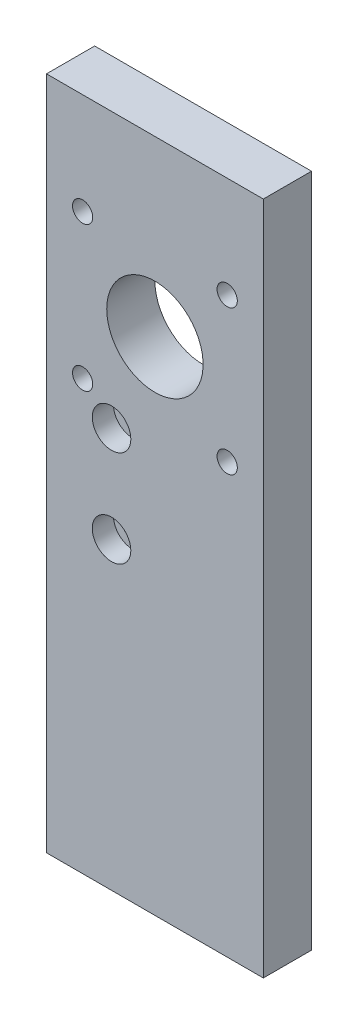
from build123d import *

# Parameters (mm, degrees)
SKIZZE1_W                                            = 45
SKIZZE1_H                                            = 140
AUFSATZ_LINEAR_AUSTRAGEN1_DEPTH                      = 5
STIRNSENKUNG_F_R_M4_ZYLINDERSCHRAUBE_MIT_D           = 4.5
STIRNSENKUNG_F_R_M4_ZYLINDERSCHRAUBE_MIT_CBORE_D     = 8
STIRNSENKUNG_F_R_M4_ZYLINDERSCHRAUBE_MIT_CBORE_DEPTH = 4.4
M5_GEWINDEBOHRUNG1_D                                 = 4.2
LINEARES_MUSTER1_COUNT                               = 2
LINEARES_MUSTER1_PITCH                               = 20
M5_GEWINDEBOHRUNG2_D                                 = 4.2
M5_GEWINDEBOHRUNG2_DEPTH                             = 14
M5_GEWINDEBOHRUNG2_TIP                               = 1.2618073
F_4_0_4_DURCHMESSER_BOHRUNG1_D                       = 4
F_4_0_4_DURCHMESSER_BOHRUNG1_DEPTH                   = 14
F_4_0_4_DURCHMESSER_BOHRUNG1_TIP                     = 1.201721238
F_3_0_3_DURCHMESSER_BOHRUNG1_D                       = 3
F_3_0_3_DURCHMESSER_BOHRUNG1_DEPTH                   = 8
F_20_0_20_DURCHMESSER_BOHRUNG1_D                     = 20


with BuildPart() as part:
    # Skizze1 → Aufsatz-Linear austragen1 (new, symmetric)
    with BuildSketch(Plane.XY):
        with Locations((0, 70)):
            Rectangle(SKIZZE1_W, SKIZZE1_H)
    extrude(amount=AUFSATZ_LINEAR_AUSTRAGEN1_DEPTH, both=True)

    # Stirnsenkung für M4 Zylinderschraube mit Innensechskant1 (through all)
    with Locations(Plane.XY.offset(5)):
        with Locations((-9, 83.08)):
            stirnsenkung_f_r_m4_zylinderschraube_mit = CounterBoreHole(STIRNSENKUNG_F_R_M4_ZYLINDERSCHRAUBE_MIT_D / 2, STIRNSENKUNG_F_R_M4_ZYLINDERSCHRAUBE_MIT_CBORE_D / 2, STIRNSENKUNG_F_R_M4_ZYLINDERSCHRAUBE_MIT_CBORE_DEPTH)

    # M5 Gewindebohrung1 (through all)
    with Locations(Plane.XY.offset(5)):
        with Locations((15, 119), (-15, 89), (-15, 119), (15, 89)):
            Hole(M5_GEWINDEBOHRUNG1_D / 2)

    # Lineares Muster1: Stirnsenkung für M4 Zylinderschraube mit Innensechskant1 ×2
    with Locations(*[(0, -i * LINEARES_MUSTER1_PITCH, 0) for i in range(1, LINEARES_MUSTER1_COUNT)]):
        add(stirnsenkung_f_r_m4_zylinderschraube_mit, mode=Mode.SUBTRACT)

    # M5 Gewindebohrung2
    with Locations(Plane(origin=(0, 0, 0), x_dir=(-1, 0, 0), z_dir=(0, -1, 0))):
        with Locations((0, 0)):
            Hole(M5_GEWINDEBOHRUNG2_D / 2, depth=M5_GEWINDEBOHRUNG2_DEPTH)
            with Locations((0, 0, -(M5_GEWINDEBOHRUNG2_DEPTH + M5_GEWINDEBOHRUNG2_TIP / 2))):  # 118° drill point
                Cone(0, M5_GEWINDEBOHRUNG2_D / 2, M5_GEWINDEBOHRUNG2_TIP, mode=Mode.SUBTRACT)

    # Ø4.0 (4) Durchmesser Bohrung1
    with Locations(Plane(origin=(0, 0, 0), x_dir=(-1, 0, 0), z_dir=(0, -1, 0))):
        with Locations((15, 0), (-15, 0)):
            Hole(F_4_0_4_DURCHMESSER_BOHRUNG1_D / 2, depth=F_4_0_4_DURCHMESSER_BOHRUNG1_DEPTH)
            with Locations((0, 0, -(F_4_0_4_DURCHMESSER_BOHRUNG1_DEPTH + F_4_0_4_DURCHMESSER_BOHRUNG1_TIP / 2))):  # 118° drill point
                Cone(0, F_4_0_4_DURCHMESSER_BOHRUNG1_D / 2, F_4_0_4_DURCHMESSER_BOHRUNG1_TIP, mode=Mode.SUBTRACT)

    # Ø3.0 (3) Durchmesser Bohrung1
    with Locations(Plane(origin=(0, 0, -5), x_dir=(-1, 0, 0), z_dir=(0, 0, -1))):
        with Locations((17.5, 76.5), (-2.5, 76.5)):
            Hole(F_3_0_3_DURCHMESSER_BOHRUNG1_D / 2, depth=F_3_0_3_DURCHMESSER_BOHRUNG1_DEPTH)

    # Ø20.0 (20) Durchmesser Bohrung1 (through all)
    with Locations(Plane(origin=(0, 0, -5), x_dir=(-1, 0, 0), z_dir=(0, 0, -1))):
        with Locations((0, 104)):
            Hole(F_20_0_20_DURCHMESSER_BOHRUNG1_D / 2)


solid = part.part
